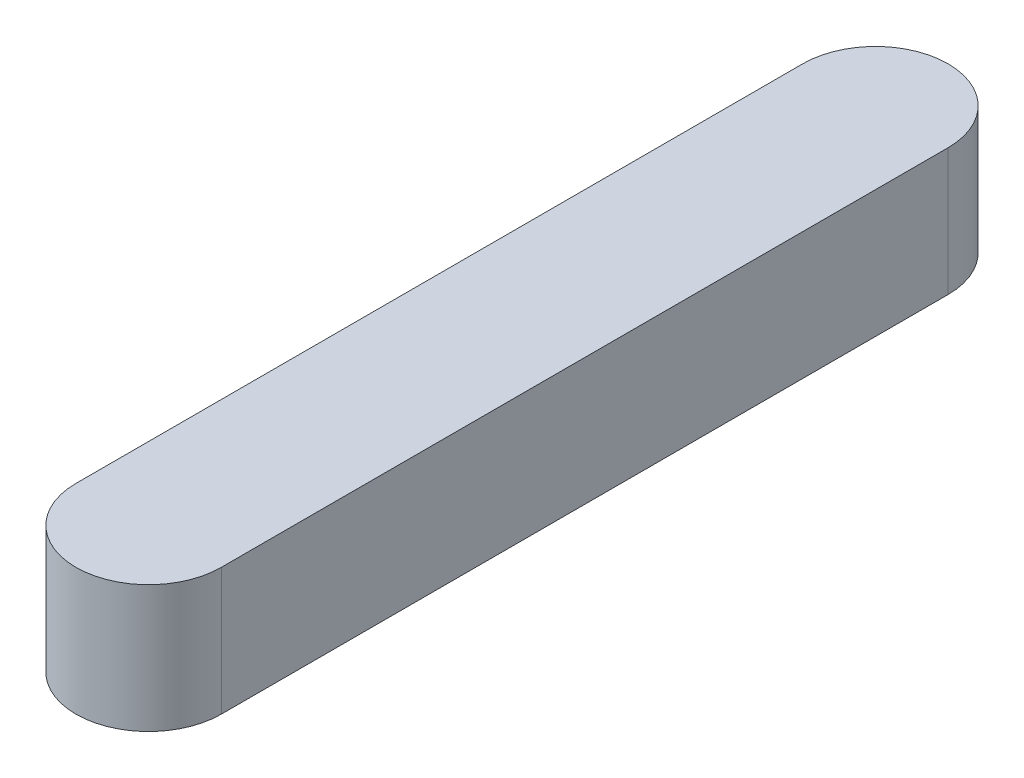
from build123d import *

# Parameters (mm, degrees)
BOSS_EXTRUDE1_DEPTH = 3.5


with BuildPart() as part:
    # Sketch1 → Boss-Extrude1 (new, symmetric)
    with BuildSketch(Plane(origin=(0, 0, 0), x_dir=(1, 0, 0), z_dir=(0, 1, 0))):
        with BuildLine():
            Line((4, 20), (4, -20))
            ThreePointArc((4, -20), (0, -24), (-4, -20))
            Line((-4, -20), (-4, 20))
            ThreePointArc((-4, 20), (0, 24), (4, 20))
        make_face()
    extrude(amount=BOSS_EXTRUDE1_DEPTH, both=True)


solid = part.part
